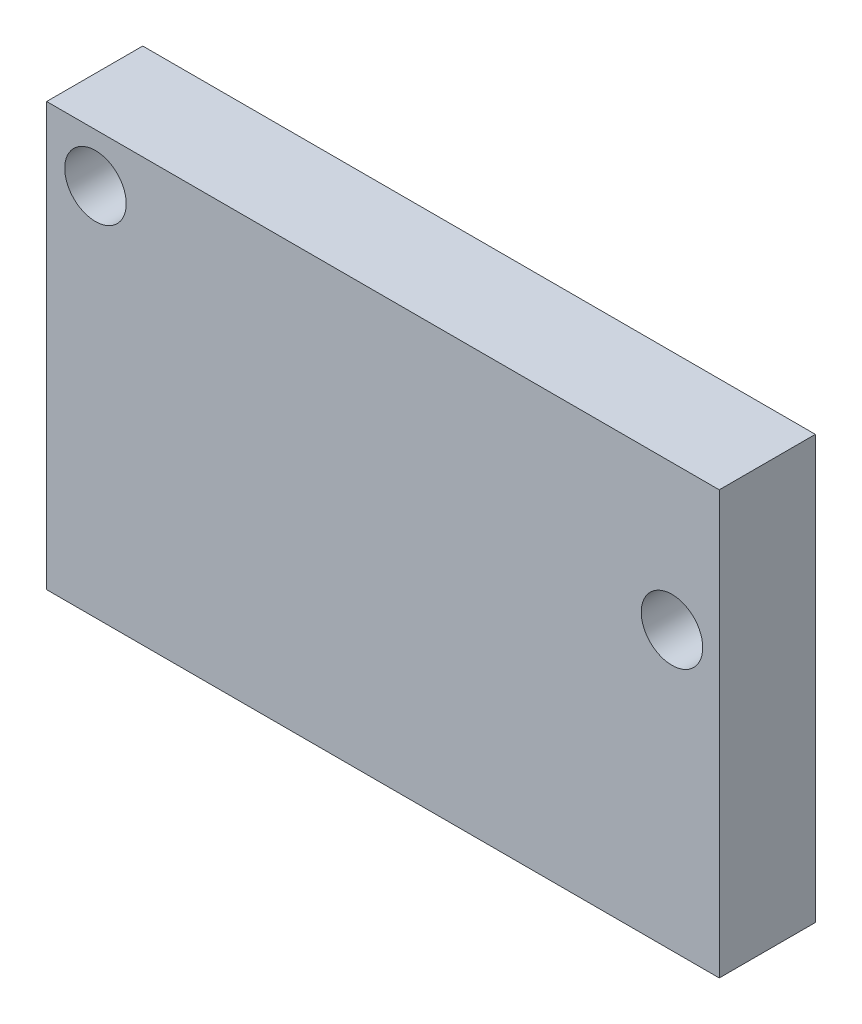
from build123d import *

# Parameters (mm, degrees)
SKETCH_1_W      = 35
SKETCH_1_H      = 22
SKETCH_1_R      = 1.6
EXTRUDE_1_DEPTH = 5


with BuildPart() as part:
    # 草图1 → 凸台-拉伸1 (new body)
    with BuildSketch(Plane.XY):
        with Locations((-17.5, 11)):
            Rectangle(SKETCH_1_W, SKETCH_1_H)
        with Locations((-32.46, 19.46)):
            Circle(SKETCH_1_R, mode=Mode.SUBTRACT)
        with Locations((-2.46, 14.46)):
            Circle(SKETCH_1_R, mode=Mode.SUBTRACT)
    extrude(amount=EXTRUDE_1_DEPTH)


solid = part.part
